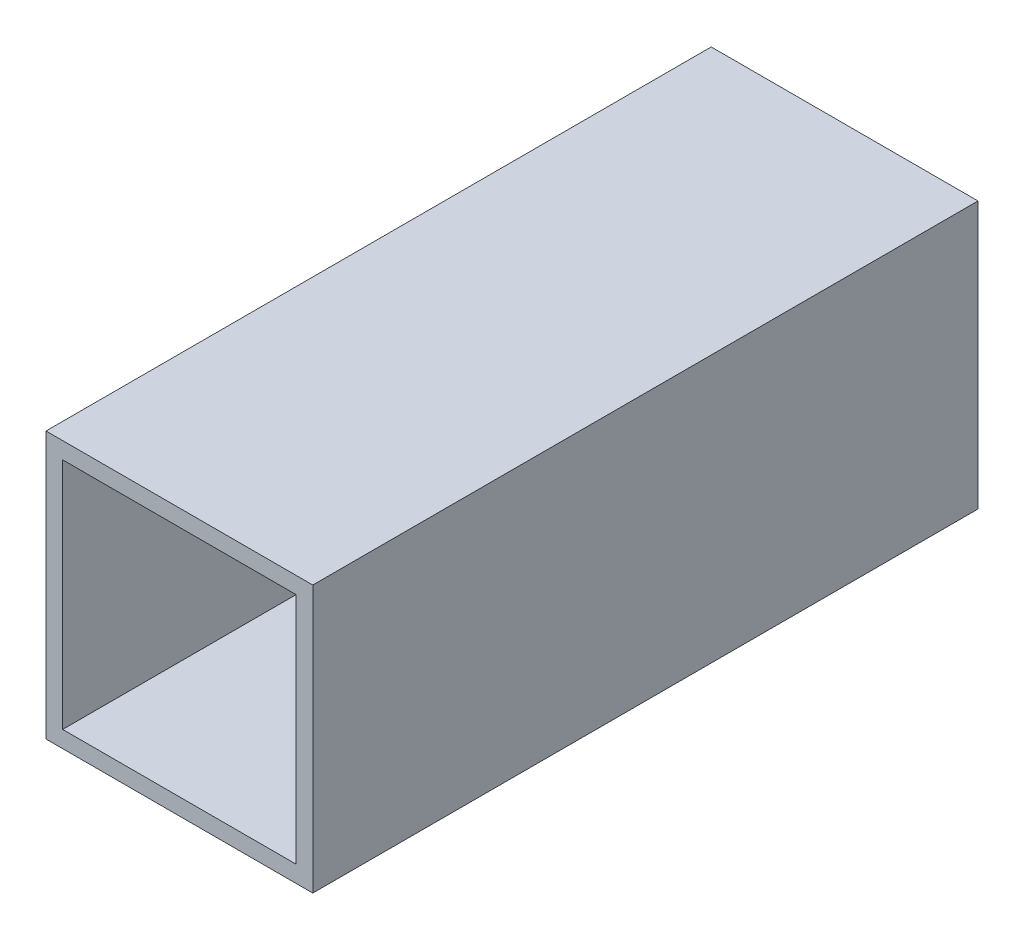
from build123d import *

# Parameters (mm, degrees)
CROQUIS2_W              = 76.2
CROQUIS2_H              = 76.2
CROQUIS2_W_2            = 66.675
CROQUIS2_H_2            = 66.675
SALIENTE_EXTRUIR1_DEPTH = 190


with BuildPart() as part:
    # Croquis2 → Saliente-Extruir1 (new body)
    with BuildSketch(Plane.XY):
        with Locations((38.1, -38.1)):
            Rectangle(CROQUIS2_W, CROQUIS2_H)
        with Locations((38.1, -38.1)):
            Rectangle(CROQUIS2_W_2, CROQUIS2_H_2, mode=Mode.SUBTRACT)
    extrude(amount=-SALIENTE_EXTRUIR1_DEPTH)


solid = part.part
